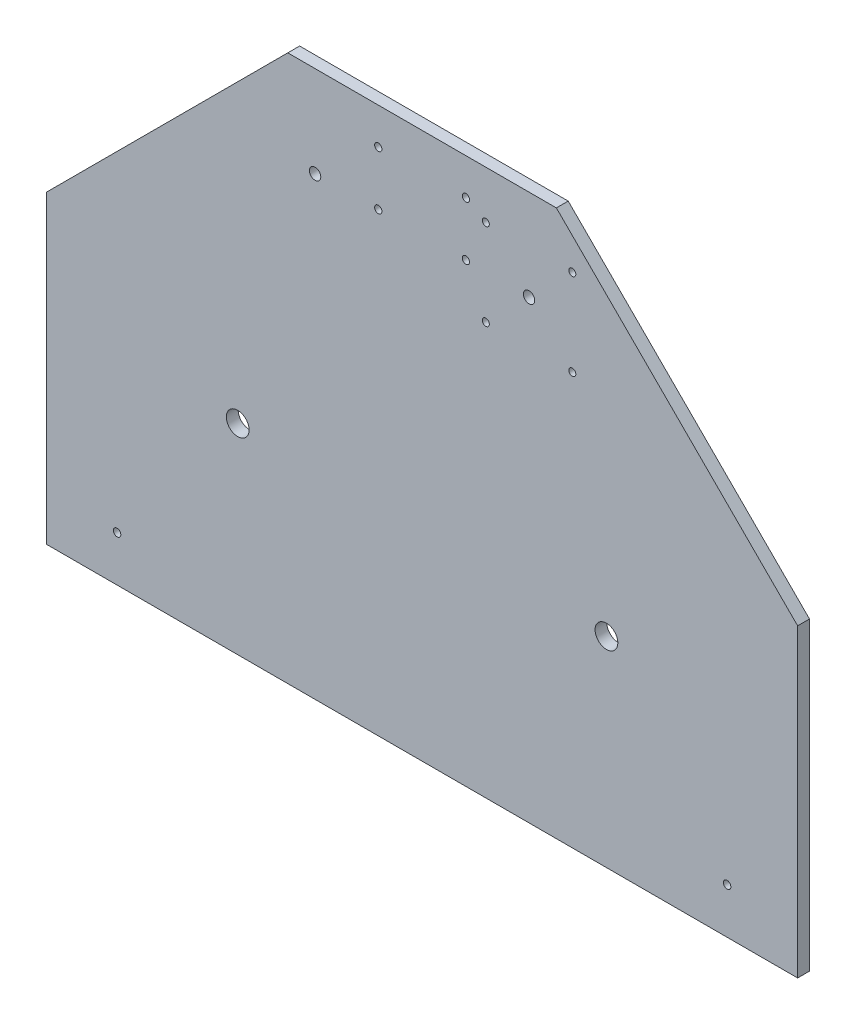
from build123d import *

# Parameters (mm, degrees)
REFERENCE_R         = 6.35
REFERENCE_R_2       = 3.175
REFERENCE_R_3       = 2.0955
REFERENCE_R_4       = 1.9685
REFERENCE_R_5       = 2.032
BOSS_EXTRUDE3_DEPTH = 6.604


with BuildPart() as part:
    # reference → Boss-Extrude3 (new body)
    with BuildSketch(Plane.XY):
        Polygon((209.55, 0), (-209.55, 0), (-209.55, 170.18), (-74.93, 304.8), (74.93, 304.8), (209.55, 170.18), align=None)
        with Locations(Location((-102.87, 111.76, 0), (0, 0, 180))):
            Circle(REFERENCE_R, mode=Mode.SUBTRACT)
        with Locations(Location((102.87, 111.76, 0), (0, 0, 180))):
            Circle(REFERENCE_R, mode=Mode.SUBTRACT)
        with Locations(Location((-59.69, 254, 0), (0, 0, 180))):
            Circle(REFERENCE_R_2, mode=Mode.SUBTRACT)
        with Locations(Location((59.69, 254, 0), (0, 0, 180))):
            Circle(REFERENCE_R_2, mode=Mode.SUBTRACT)
        with Locations(Location((170.18, 25.4, 0), (0, 0, 180))):
            Circle(REFERENCE_R_3, mode=Mode.SUBTRACT)
        with Locations(Location((-170.18, 25.4, 0), (0, 0, 180))):
            Circle(REFERENCE_R_3, mode=Mode.SUBTRACT)
        with Locations(Location((83.82, 229.87, 0), (0, 0, 180))):
            Circle(REFERENCE_R_4, mode=Mode.SUBTRACT)
        with Locations(Location((35.56, 229.87, 0), (0, 0, 180))):
            Circle(REFERENCE_R_4, mode=Mode.SUBTRACT)
        with Locations(Location((83.82, 278.13, 0), (0, 0, 180))):
            Circle(REFERENCE_R_4, mode=Mode.SUBTRACT)
        with Locations(Location((35.56, 278.13, 0), (0, 0, 180))):
            Circle(REFERENCE_R_4, mode=Mode.SUBTRACT)
        with Locations(Location((24.4475, 284.48, 0), (0, 0, 180))):
            Circle(REFERENCE_R_5, mode=Mode.SUBTRACT)
        with Locations(Location((24.4475, 254.381, 0), (0, 0, 180))):
            Circle(REFERENCE_R_5, mode=Mode.SUBTRACT)
        with Locations(Location((-24.4475, 254.381, 0), (0, 0, 180))):
            Circle(REFERENCE_R_5, mode=Mode.SUBTRACT)
        with Locations(Location((-24.4475, 284.48, 0), (0, 0, 180))):
            Circle(REFERENCE_R_5, mode=Mode.SUBTRACT)
    extrude(amount=BOSS_EXTRUDE3_DEPTH)


solid = part.part
